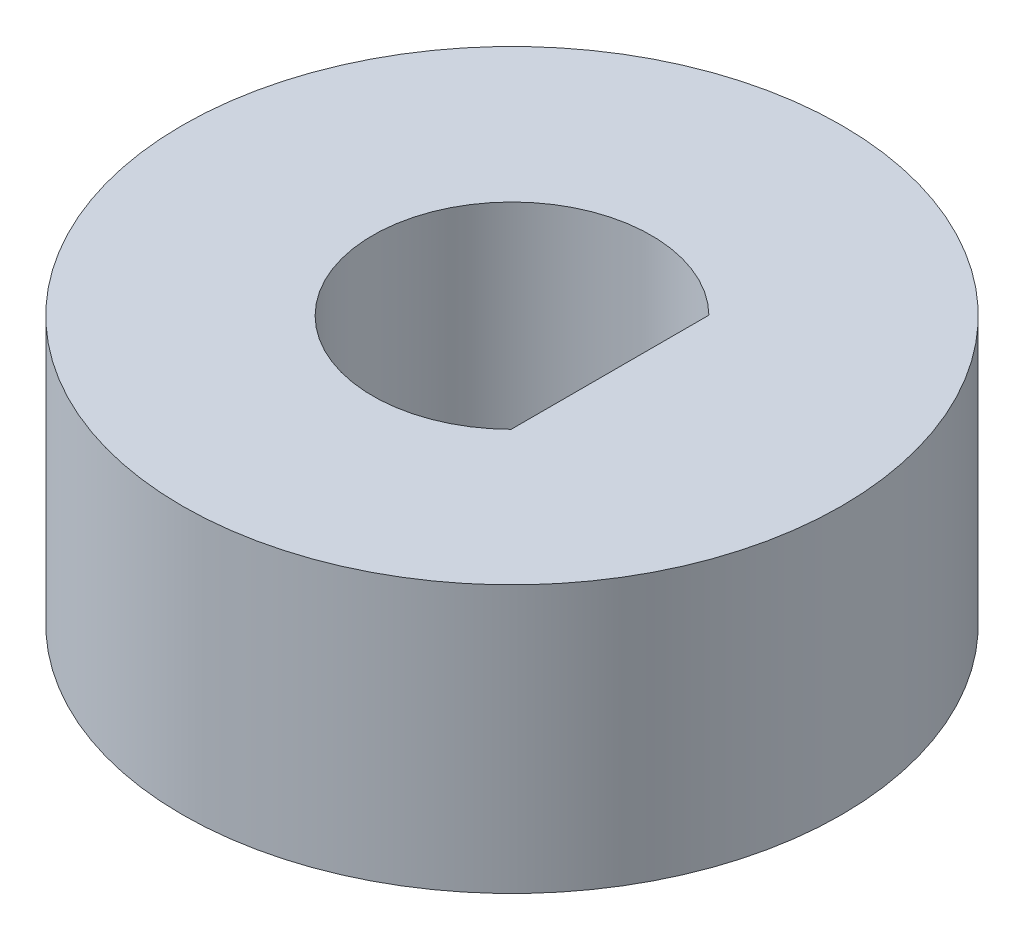
from build123d import *

# Parameters (mm, degrees)
SKETCH1_R           = 7.4
BOSS_EXTRUDE1_DEPTH = 6


with BuildPart() as part:
    # Sketch1 → Boss-Extrude1 (new body)
    with BuildSketch(Plane(origin=(0, 0, 0), x_dir=(1, 0, 0), z_dir=(0, 1, 0))):
        with Locations(Location((0, 0, 0), (0, 0, 270))):
            Circle(SKETCH1_R)
        with BuildLine():
            Line((2.2, 2.219374912), (2.2, -2.219374912))
            ThreePointArc((2.2, -2.219374912), (-3.125, 0), (2.2, 2.219374912))
        make_face(mode=Mode.SUBTRACT)
    extrude(amount=BOSS_EXTRUDE1_DEPTH)


solid = part.part
